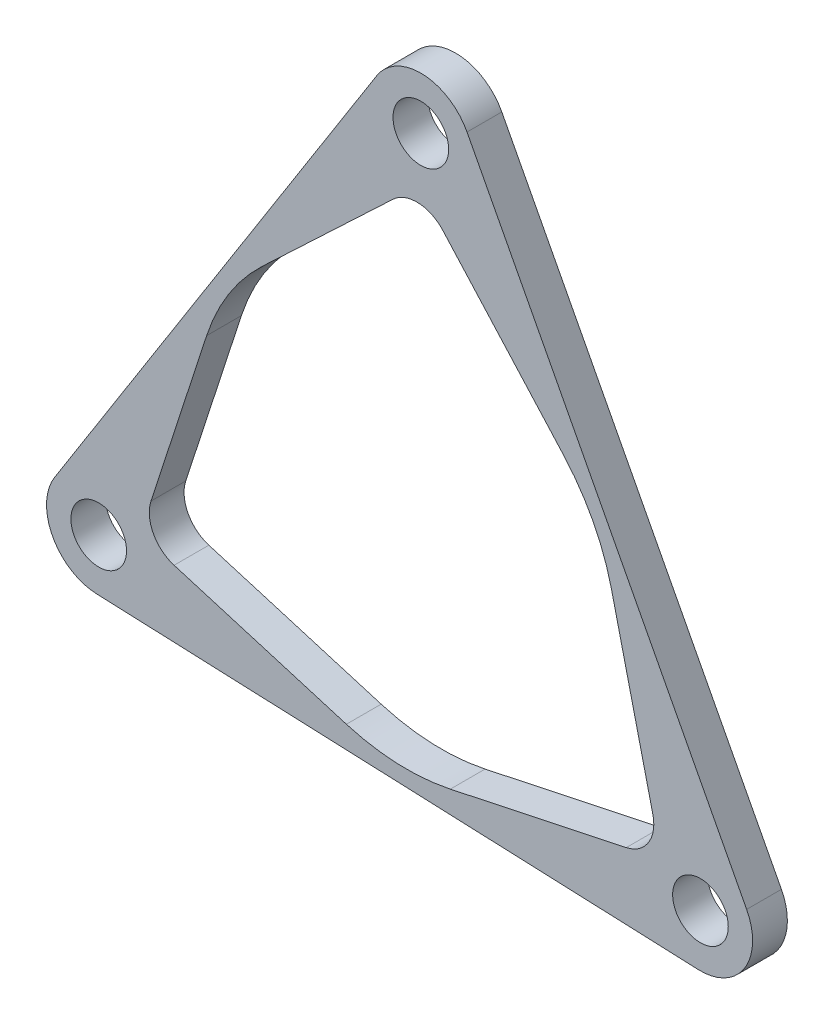
from build123d import *

# Parameters (mm, degrees)
SKETCH1_R           = 3
SKETCH1_R_2         = 1.6
BOSS_EXTRUDE1_DEPTH = 2


with BuildPart() as part:
    # Sketch1 → Boss-Extrude1 (new body)
    # profile 1 of 4: a face of its own
    with BuildSketch(Plane.XY):
        with BuildLine():
            ThreePointArc((3.814909487, 19.983391167), (-0.020434351, 17.102037202), (-1.719890963, 21.588005352))
            Line((-1.719890963, 21.588005352), (-20.248379597, -7.681349081))
            ThreePointArc((-20.248379597, -7.681349081), (-16.87823531, -6.404609301), (-14.713579148, -9.285963266))
            ThreePointArc((-14.713579148, -9.285963266), (-15.635925335, -11.450069233), (-17.835815571, -12.283471941))
            Line((-17.835815571, -12.283471941), (16.776433238, -13.694936576))
            ThreePointArc((16.776433238, -13.694936576), (14.363869212, -9.092813716), (19.555706533, -9.304533411))
            Line((19.555706533, -9.304533411), (3.471946359, 21.376285657))
            ThreePointArc((3.471946359, 21.376285657), (3.727907136, 20.700639166), (3.814909487, 19.983391167))
        make_face()
        with BuildLine():
            Line((-8.306162696, 8.798730663), (-0.783837106, 15.899943621))
            ThreePointArc((-0.783837106, 15.899943621), (0.670573296, 16.443947091), (2.075859948, 15.783327064))
            Line((2.075859948, 15.783327064), (8.995004486, 8.093200498))
            ThreePointArc((8.995004486, 8.093200498), (10.716715384, 5.618007776), (11.773005623, 2.793982571))
            Line((11.773005623, 2.793982571), (14.161673647, -7.271148964))
            ThreePointArc((14.161673647, -7.271148964), (13.905589271, -8.802707055), (12.63083222, -9.689410982))
            Line((12.63083222, -9.689410982), (2.511414986, -11.836502641))
            ThreePointArc((2.511414986, -11.836502641), (-0.493020239, -12.089951656), (-3.466842927, -11.592713234))
            Line((-3.466842927, -11.592713234), (-13.377836541, -8.628794657))
            ThreePointArc((-13.377836541, -8.628794657), (-14.576162567, -7.641240036), (-14.706692168, -6.093916082))
            Line((-14.706692168, -6.093916082), (-11.506419472, 3.743302143))
            ThreePointArc((-11.506419472, 3.743302143), (-10.223695145, 6.47194388), (-8.306162696, 8.798730663))
        make_face(mode=Mode.SUBTRACT)
    # profile 2 of 4: a face of its own
    with BuildSketch(Plane.XY):
        with Locations((0.814909487, 19.983391167)):
            Circle(SKETCH1_R)
        with Locations((0.814909487, 19.983391167)):
            Circle(SKETCH1_R_2, mode=Mode.SUBTRACT)
    # profile 3 of 4: a face of its own
    with BuildSketch(Plane.XY):
        with Locations((16.898669661, -10.697427901)):
            Circle(SKETCH1_R)
        with Locations((16.898669661, -10.697427901)):
            Circle(SKETCH1_R_2, mode=Mode.SUBTRACT)
    # profile 4 of 4: a face of its own
    with BuildSketch(Plane.XY):
        with Locations((-17.713579148, -9.285963266)):
            Circle(SKETCH1_R)
        with Locations((-17.713579148, -9.285963266)):
            Circle(SKETCH1_R_2, mode=Mode.SUBTRACT)
    extrude(amount=BOSS_EXTRUDE1_DEPTH)


solid = part.part
